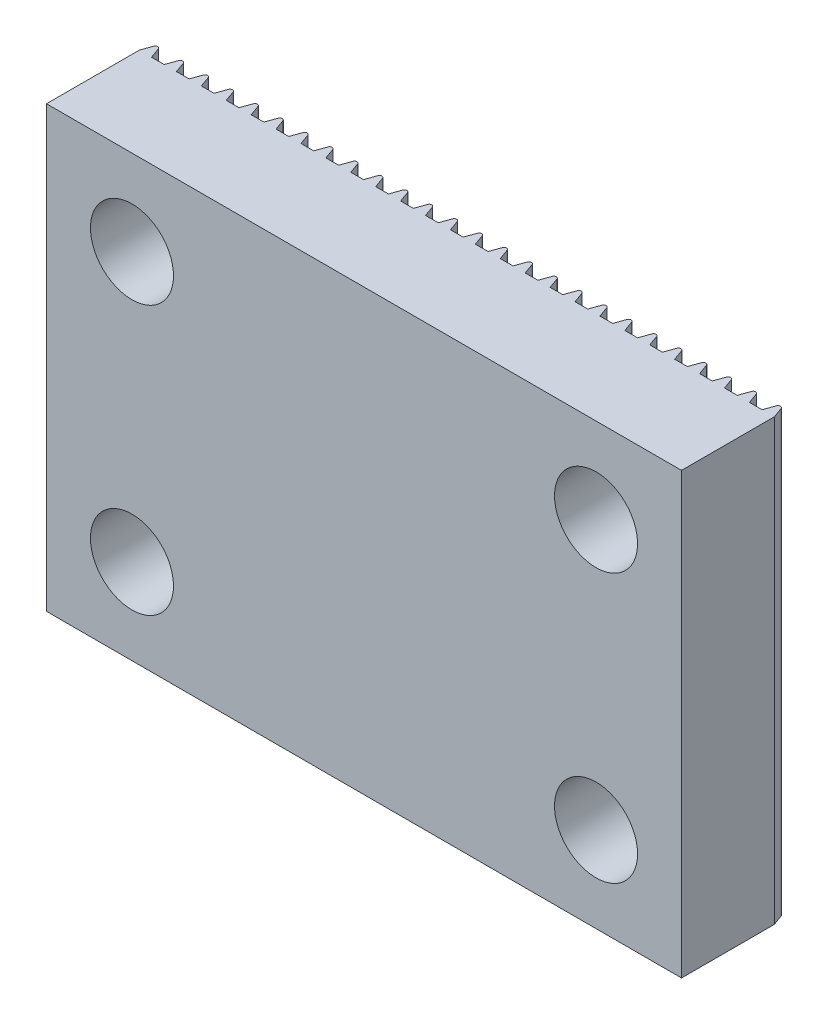
from build123d import *

# Parameters (mm, degrees)
EXTRUDE_1_DEPTH     = 18
CUT_EXTRUDE_1_REACH = 33.914
SKETCH_2_R          = 1.7


with BuildPart() as part:
    # 草图1 → 凸台-拉伸1 (new body)
    with BuildSketch(Plane(origin=(0, 0, 0), x_dir=(1, 0, 0), z_dir=(0, 1, 0))):
        with BuildLine():
            Line((0.155825809, 4.236312265), (0, 3.8))
            Line((0, 3.8), (0, 0))
            Line((0, 0), (26, 0))
            Line((26, 0), (26, 3.8))
            Line((26, 3.8), (25.844174191, 4.236312265))
            ThreePointArc((25.844174191, 4.236312265), (25.75, 4.302678625), (25.655825809, 4.236312265))
            Line((25.655825809, 4.236312265), (25.5, 3.8))
            Line((25.5, 3.8), (24.98, 3.8))
            Line((24.98, 3.8), (24.824174191, 4.236312265))
            ThreePointArc((24.824174191, 4.236312265), (24.73, 4.302678625), (24.635825809, 4.236312265))
            Line((24.635825809, 4.236312265), (24.48, 3.8))
            Line((24.48, 3.8), (23.96, 3.8))
            Line((23.96, 3.8), (23.804174191, 4.236312265))
            ThreePointArc((23.804174191, 4.236312265), (23.71, 4.302678625), (23.615825809, 4.236312265))
            Line((23.615825809, 4.236312265), (23.46, 3.8))
            Line((23.46, 3.8), (22.94, 3.8))
            Line((22.94, 3.8), (22.784174191, 4.236312265))
            ThreePointArc((22.784174191, 4.236312265), (22.69, 4.302678625), (22.595825809, 4.236312265))
            Line((22.595825809, 4.236312265), (22.44, 3.8))
            Line((22.44, 3.8), (21.92, 3.8))
            Line((21.92, 3.8), (21.764174191, 4.236312265))
            ThreePointArc((21.764174191, 4.236312265), (21.67, 4.302678625), (21.575825809, 4.236312265))
            Line((21.575825809, 4.236312265), (21.42, 3.8))
            Line((21.42, 3.8), (20.9, 3.8))
            Line((20.9, 3.8), (20.744174191, 4.236312265))
            ThreePointArc((20.744174191, 4.236312265), (20.65, 4.302678625), (20.555825809, 4.236312265))
            Line((20.555825809, 4.236312265), (20.4, 3.8))
            Line((20.4, 3.8), (19.88, 3.8))
            Line((19.88, 3.8), (19.724174191, 4.236312265))
            ThreePointArc((19.724174191, 4.236312265), (19.63, 4.302678625), (19.535825809, 4.236312265))
            Line((19.535825809, 4.236312265), (19.38, 3.8))
            Line((19.38, 3.8), (18.86, 3.8))
            Line((18.86, 3.8), (18.704174191, 4.236312265))
            ThreePointArc((18.704174191, 4.236312265), (18.61, 4.302678625), (18.515825809, 4.236312265))
            Line((18.515825809, 4.236312265), (18.36, 3.8))
            Line((18.36, 3.8), (17.84, 3.8))
            Line((17.84, 3.8), (17.684174191, 4.236312265))
            ThreePointArc((17.684174191, 4.236312265), (17.59, 4.302678625), (17.495825809, 4.236312265))
            Line((17.495825809, 4.236312265), (17.34, 3.8))
            Line((17.34, 3.8), (16.82, 3.8))
            Line((16.82, 3.8), (16.664174191, 4.236312265))
            ThreePointArc((16.664174191, 4.236312265), (16.57, 4.302678625), (16.475825809, 4.236312265))
            Line((16.475825809, 4.236312265), (16.32, 3.8))
            Line((16.32, 3.8), (15.8, 3.8))
            Line((15.8, 3.8), (15.644174191, 4.236312265))
            ThreePointArc((15.644174191, 4.236312265), (15.55, 4.302678625), (15.455825809, 4.236312265))
            Line((15.455825809, 4.236312265), (15.3, 3.8))
            Line((15.3, 3.8), (14.78, 3.8))
            Line((14.78, 3.8), (14.624174191, 4.236312265))
            ThreePointArc((14.624174191, 4.236312265), (14.53, 4.302678625), (14.435825809, 4.236312265))
            Line((14.435825809, 4.236312265), (14.28, 3.8))
            Line((14.28, 3.8), (13.76, 3.8))
            Line((13.76, 3.8), (13.604174191, 4.236312265))
            ThreePointArc((13.604174191, 4.236312265), (13.51, 4.302678625), (13.415825809, 4.236312265))
            Line((13.415825809, 4.236312265), (13.26, 3.8))
            Line((13.26, 3.8), (12.74, 3.8))
            Line((12.74, 3.8), (12.584174191, 4.236312265))
            ThreePointArc((12.584174191, 4.236312265), (12.49, 4.302678625), (12.395825809, 4.236312265))
            Line((12.395825809, 4.236312265), (12.24, 3.8))
            Line((12.24, 3.8), (11.72, 3.8))
            Line((11.72, 3.8), (11.564174191, 4.236312265))
            ThreePointArc((11.564174191, 4.236312265), (11.47, 4.302678625), (11.375825809, 4.236312265))
            Line((11.375825809, 4.236312265), (11.22, 3.8))
            Line((11.22, 3.8), (10.7, 3.8))
            Line((10.7, 3.8), (10.544174191, 4.236312265))
            ThreePointArc((10.544174191, 4.236312265), (10.45, 4.302678625), (10.355825809, 4.236312265))
            Line((10.355825809, 4.236312265), (10.2, 3.8))
            Line((10.2, 3.8), (9.68, 3.8))
            Line((9.68, 3.8), (9.524174191, 4.236312265))
            ThreePointArc((9.524174191, 4.236312265), (9.43, 4.302678625), (9.335825809, 4.236312265))
            Line((9.335825809, 4.236312265), (9.18, 3.8))
            Line((9.18, 3.8), (8.66, 3.8))
            Line((8.66, 3.8), (8.504174191, 4.236312265))
            ThreePointArc((8.504174191, 4.236312265), (8.41, 4.302678625), (8.315825809, 4.236312265))
            Line((8.315825809, 4.236312265), (8.16, 3.8))
            Line((8.16, 3.8), (7.64, 3.8))
            Line((7.64, 3.8), (7.484174191, 4.236312265))
            ThreePointArc((7.484174191, 4.236312265), (7.39, 4.302678625), (7.295825809, 4.236312265))
            Line((7.295825809, 4.236312265), (7.14, 3.8))
            Line((7.14, 3.8), (6.62, 3.8))
            Line((6.62, 3.8), (6.464174191, 4.236312265))
            ThreePointArc((6.464174191, 4.236312265), (6.37, 4.302678625), (6.275825809, 4.236312265))
            Line((6.275825809, 4.236312265), (6.12, 3.8))
            Line((6.12, 3.8), (5.6, 3.8))
            Line((5.6, 3.8), (5.444174191, 4.236312265))
            ThreePointArc((5.444174191, 4.236312265), (5.35, 4.302678625), (5.255825809, 4.236312265))
            Line((5.255825809, 4.236312265), (5.1, 3.8))
            Line((5.1, 3.8), (4.58, 3.8))
            Line((4.58, 3.8), (4.424174191, 4.236312265))
            ThreePointArc((4.424174191, 4.236312265), (4.33, 4.302678625), (4.235825809, 4.236312265))
            Line((4.235825809, 4.236312265), (4.08, 3.8))
            Line((4.08, 3.8), (3.56, 3.8))
            Line((3.56, 3.8), (3.404174191, 4.236312265))
            ThreePointArc((3.404174191, 4.236312265), (3.31, 4.302678625), (3.215825809, 4.236312265))
            Line((3.215825809, 4.236312265), (3.06, 3.8))
            Line((3.06, 3.8), (2.54, 3.8))
            Line((2.54, 3.8), (2.384174191, 4.236312265))
            ThreePointArc((2.384174191, 4.236312265), (2.29, 4.302678625), (2.195825809, 4.236312265))
            Line((2.195825809, 4.236312265), (2.04, 3.8))
            Line((2.04, 3.8), (1.52, 3.8))
            Line((1.52, 3.8), (1.364174191, 4.236312265))
            ThreePointArc((1.364174191, 4.236312265), (1.27, 4.302678625), (1.175825809, 4.236312265))
            Line((1.175825809, 4.236312265), (1.02, 3.8))
            Line((1.02, 3.8), (0.5, 3.8))
            Line((0.5, 3.8), (0.344174191, 4.236312265))
            ThreePointArc((0.344174191, 4.236312265), (0.25, 4.302678625), (0.155825809, 4.236312265))
        make_face()
    extrude(amount=EXTRUDE_1_DEPTH)

    # 草图2 → 切除-拉伸1 (cut, up to next)
    with BuildSketch(Plane.XY, mode=Mode.PRIVATE) as cut_extrude_1_sk1:
        with Locations((3.5, 14.5)):
            Circle(SKETCH_2_R)
    cut_extrude_1_tool1 = extrude(cut_extrude_1_sk1.sketch, amount=-CUT_EXTRUDE_1_REACH, mode=Mode.PRIVATE) & part.part
    # 草图2 → 切除-拉伸1 (cut, up to next)
    with BuildSketch(Plane.XY, mode=Mode.PRIVATE) as cut_extrude_1_sk2:
        with Locations(Location((3.5, 3.5, 0), (0, 0, 340.250077204))):
            Circle(SKETCH_2_R)
    cut_extrude_1_tool2 = extrude(cut_extrude_1_sk2.sketch, amount=-CUT_EXTRUDE_1_REACH, mode=Mode.PRIVATE) & part.part
    # 草图2 → 切除-拉伸1 (cut, up to next)
    with BuildSketch(Plane.XY, mode=Mode.PRIVATE) as cut_extrude_1_sk3:
        with Locations((22.5, 3.5)):
            Circle(SKETCH_2_R)
    cut_extrude_1_tool3 = extrude(cut_extrude_1_sk3.sketch, amount=-CUT_EXTRUDE_1_REACH, mode=Mode.PRIVATE) & part.part
    # 草图2 → 切除-拉伸1 (cut, up to next)
    with BuildSketch(Plane.XY, mode=Mode.PRIVATE) as cut_extrude_1_sk4:
        with Locations(Location((22.5, 14.5, 0), (0, 0, 30.815255635))):
            Circle(SKETCH_2_R)
    cut_extrude_1_tool4 = extrude(cut_extrude_1_sk4.sketch, amount=-CUT_EXTRUDE_1_REACH, mode=Mode.PRIVATE) & part.part
    add(cut_extrude_1_tool1.solids().sort_by_distance((3.5, 14.5, 0))[0], mode=Mode.SUBTRACT)
    add(cut_extrude_1_tool2.solids().sort_by_distance((3.5, 3.5, 0))[0], mode=Mode.SUBTRACT)
    add(cut_extrude_1_tool3.solids().sort_by_distance((22.5, 3.5, 0))[0], mode=Mode.SUBTRACT)
    add(cut_extrude_1_tool4.solids().sort_by_distance((22.5, 14.5, 0))[0], mode=Mode.SUBTRACT)


solid = part.part
